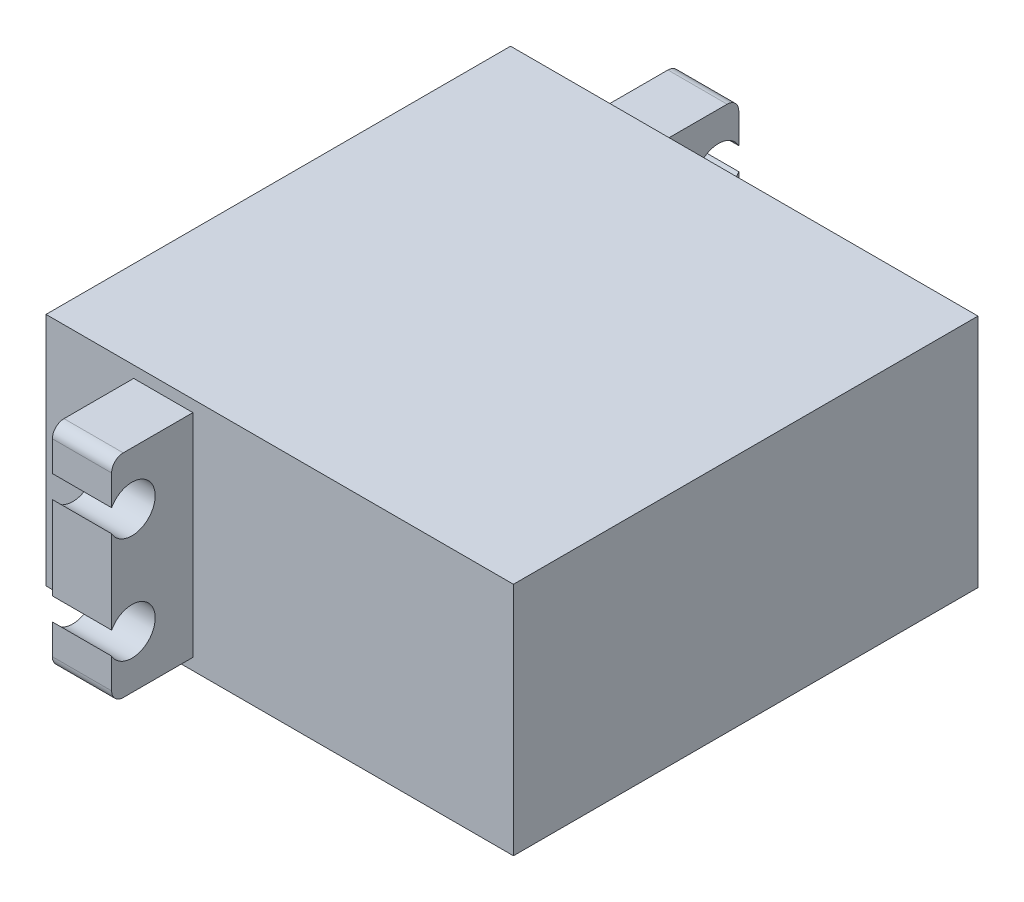
from build123d import *

# Parameters (mm, degrees)
SKETCH1_W           = 40.25
SKETCH1_H           = 40
BOSS_EXTRUDE1_DEPTH = 20.25
SKETCH2_R           = 6.5
BOSS_EXTRUDE2_DEPTH = 1.35
SKETCH3_R           = 3
BOSS_EXTRUDE3_DEPTH = 4.25
BOSS_EXTRUDE4_DEPTH = 5.1


with BuildPart() as part:
    # Sketch1 → Boss-Extrude1 (new body)
    with BuildSketch(Plane(origin=(0, 0, 0), x_dir=(1, 0, 0), z_dir=(0, 1, 0))):
        with Locations((20.125, 20)):
            Rectangle(SKETCH1_W, SKETCH1_H)
    extrude(amount=BOSS_EXTRUDE1_DEPTH)

    # Sketch2 → Boss-Extrude2 (add)
    with BuildSketch(Plane.ZY):
        with Locations(Location((-29.5, 10.125, 0), (0, 0, 180))):
            Circle(SKETCH2_R)
    extrude(amount=BOSS_EXTRUDE2_DEPTH)

    # Sketch3 → Boss-Extrude3 (add)
    with BuildSketch(Plane.ZY.offset(1.35)):
        with Locations((-29.5, 10.125)):
            Circle(SKETCH3_R)
    extrude(amount=BOSS_EXTRUDE3_DEPTH)

    # Sketch4 → Boss-Extrude4 (add)
    with BuildSketch(Plane(origin=(12.65, 0, 0), x_dir=(0, 0, -1), z_dir=(1, 0, 0))):
        with BuildLine():
            Line((40, 19.25), (46, 19.25))
            ThreePointArc((46, 19.25), (46.707106781, 18.957106781), (47, 18.25))
            Line((47, 18.25), (47, 15.655745837))
            ThreePointArc((47, 15.655745837), (43.25, 14.6875), (47, 13.719254163))
            Line((47, 13.719254163), (47, 6.530745837))
            ThreePointArc((47, 6.530745837), (43.25, 5.5625), (47, 4.594254163))
            Line((47, 4.594254163), (47, 2))
            ThreePointArc((47, 2), (46.707106781, 1.292893219), (46, 1))
            Line((46, 1), (40, 1))
            Line((40, 1), (40, 19.25))
        make_face()
        with BuildLine():
            Line((0, 19.25), (-6, 19.25))
            ThreePointArc((-6, 19.25), (-6.707106781, 18.957106781), (-7, 18.25))
            Line((-7, 18.25), (-7, 15.655745837))
            ThreePointArc((-7, 15.655745837), (-3.25, 14.6875), (-7, 13.719254163))
            Line((-7, 13.719254163), (-7, 6.530745837))
            ThreePointArc((-7, 6.530745837), (-3.25, 5.5625), (-7, 4.594254163))
            Line((-7, 4.594254163), (-7, 2))
            ThreePointArc((-7, 2), (-6.707106781, 1.292893219), (-6, 1))
            Line((-6, 1), (0, 1))
            Line((0, 1), (0, 19.25))
        make_face()
    extrude(amount=-BOSS_EXTRUDE4_DEPTH)


solid = part.part
